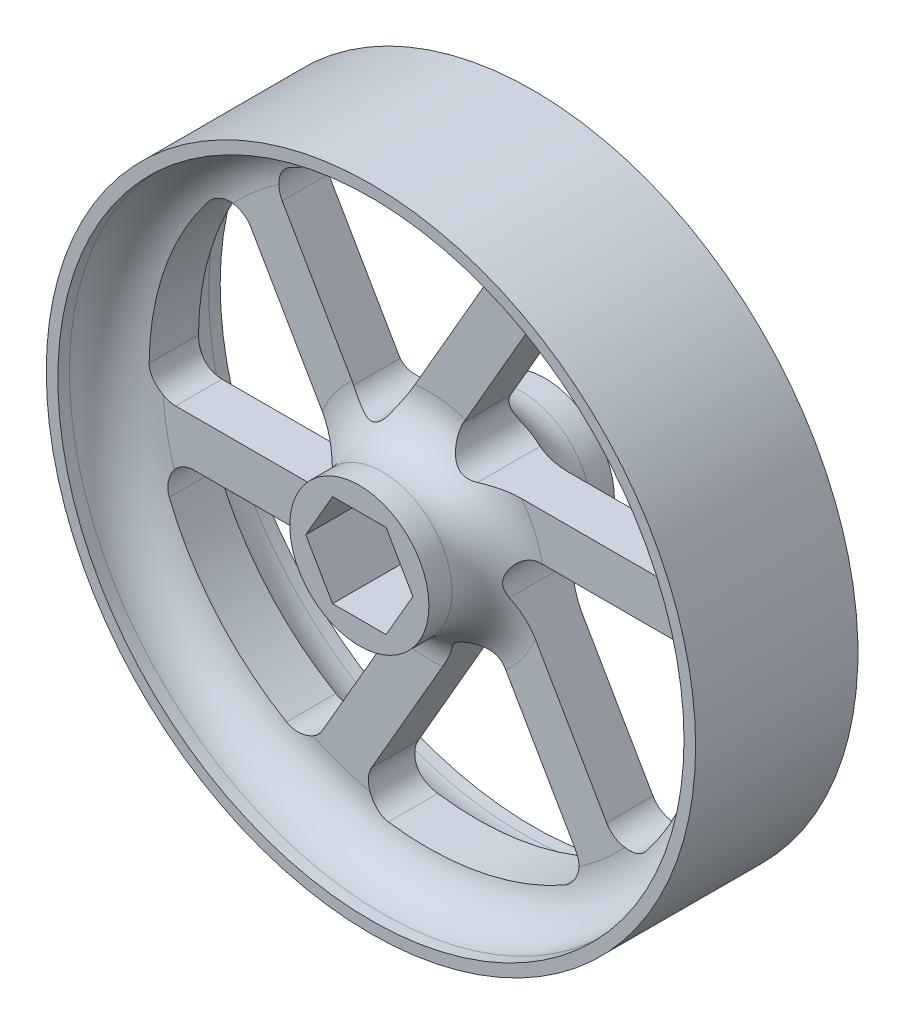
from build123d import *

# Parameters (mm, degrees)
SKETCH1_R           = 44.45
BOSS_EXTRUDE1_DEPTH = 12.7
SKETCH3_OUTSIDE_W   = 116.552
SKETCH3_OUTSIDE_H   = 116.552
SKETCH3_OUTSIDE_R   = 27.132432737
CUT_EXTRUDE1_DEPTH  = 1.5875
CUT_EXTRUDE2_DEPTH  = 65.835334695
CIRPATTERN1_COUNT   = 6


with BuildPart() as part:
    # Sketch1 → Boss-Extrude1 (new, symmetric)
    with BuildSketch(Plane.XY):
        Circle(SKETCH1_R)
        Polygon((3.666174209, -6.35), (7.332348419, 0), (3.666174209, 6.35), (-3.666174209, 6.35), (-7.332348419, 0), (-3.666174209, -6.35), align=None, mode=Mode.SUBTRACT)
    extrude(amount=BOSS_EXTRUDE1_DEPTH, both=True)

    # Sketch2 → Cut-Revolve1 (revolve, cut)
    with BuildSketch(Plane(origin=(0, 0, 0), x_dir=(1, 0, 0), z_dir=(0, 1, 0)), mode=Mode.PRIVATE) as cut_revolve1_sk:
        with BuildLine():
            Line((-36.5125, 3.175), (-15.875, 3.175))
            ThreePointArc((-15.875, 3.175), (-11.384871939, 5.034871939), (-9.525, 9.525))
            Line((-9.525, 9.525), (-9.525, 12.7))
            Line((-9.525, 12.7), (-42.8625, 12.7))
            Line((-42.8625, 12.7), (-42.8625, 9.525))
            ThreePointArc((-42.8625, 9.525), (-41.002628061, 5.034871939), (-36.5125, 3.175))
        make_face()
    cut_revolve1 = revolve(cut_revolve1_sk.sketch.rotate(Axis((0, 0, 1000), (0, 0, -1)), 180), axis=Axis((0, 0, 1000), (0, 0, -1)), mode=Mode.SUBTRACT)

    # Mirror1: Cut-Revolve1 across plane
    add(cut_revolve1.mirror(Plane.XY), mode=Mode.SUBTRACT)

    # Sketch3 outside → Cut-Extrude1 (cut)
    with BuildSketch(Plane.XY.offset(12.7)):
        Rectangle(SKETCH3_OUTSIDE_W, SKETCH3_OUTSIDE_H)
        Circle(SKETCH3_OUTSIDE_R, mode=Mode.SUBTRACT)
    cut_extrude1 = extrude(amount=-CUT_EXTRUDE1_DEPTH, mode=Mode.SUBTRACT)

    # Mirror2: Cut-Extrude1 across plane
    add(cut_extrude1.mirror(Plane.XY), mode=Mode.SUBTRACT)

    # Sketch4 → Cut-Extrude2 (cut, symmetric)
    with BuildSketch(Plane.XY.offset(3.175)):
        with BuildLine():
            Line((15.104637743, 3.175), (34.670069585, 3.175))
            ThreePointArc((34.670069585, 3.175), (37.103604102, 2.161771254), (38.098977565, -0.279120879))
            ThreePointArc((38.098977565, -0.279120879), (35.971949149, -12.555033829), (29.998399784, -23.488422901))
            ThreePointArc((29.998399784, -23.488422901), (27.057541118, -24.794985079), (24.328942694, -23.08896484))
            Line((24.328942694, -23.08896484), (12.135036633, -1.9685))
            ThreePointArc((12.135036633, -1.9685), (12.135036633, 1.4605), (15.104637743, 3.175))
        make_face()
    cut_extrude2 = extrude(amount=CUT_EXTRUDE2_DEPTH, both=True, mode=Mode.SUBTRACT)

    # CirPattern1: Cut-Extrude2 ×6 about axis
    cirpattern1_axis = Axis((0, 0, 0), (0, 0, 1))
    for i in range(1, CIRPATTERN1_COUNT):
        add(cut_extrude2.rotate(cirpattern1_axis, i * 360 / CIRPATTERN1_COUNT), mode=Mode.SUBTRACT)


solid = part.part
